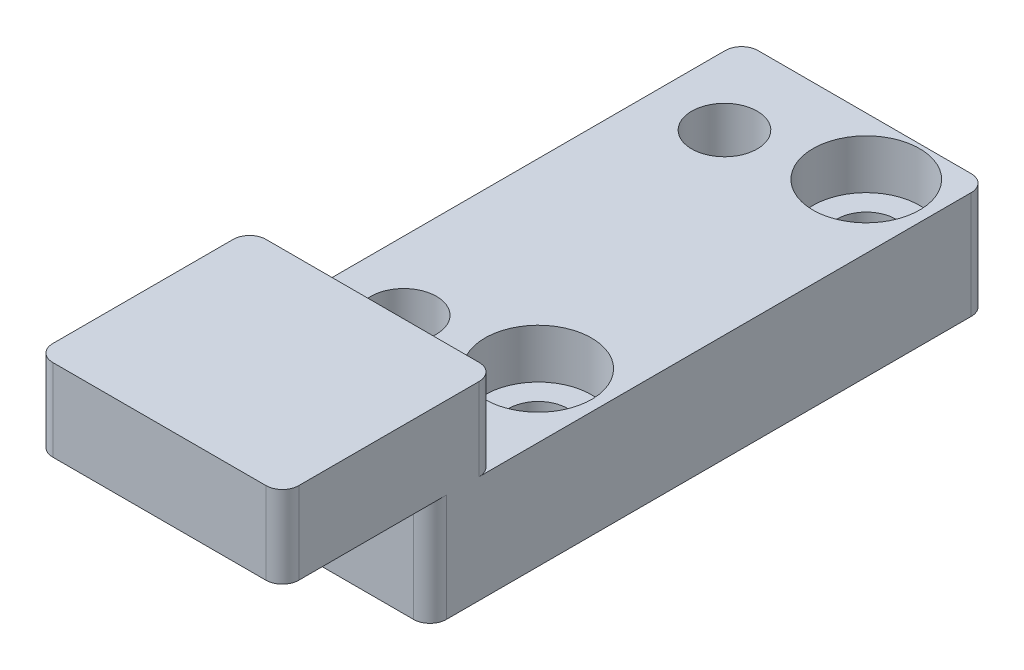
from build123d import *

# Parameters (mm, degrees)
SKETCH1_W                                      = 15
SKETCH1_H                                      = 6.539
BOSS_EXTRUDE1_DEPTH                            = 30
CBORE_FOR_M3_SHCS1_D                           = 3.6
CBORE_FOR_M3_SHCS1_CBORE_D                     = 6.5
CBORE_FOR_M3_SHCS1_CBORE_DEPTH                 = 3
CBORE_FOR_6_SOCKET_HEAD_CAP_SCREW1_D           = 3.997300108
CBORE_FOR_6_SOCKET_HEAD_CAP_SCREW1_CBORE_D     = 7.14502
CBORE_FOR_6_SOCKET_HEAD_CAP_SCREW1_CBORE_DEPTH = 3.5052
BOSS_EXTRUDE2_DEPTH                            = 15
FILLET1_R                                      = 1


with BuildPart() as part:
    # Sketch1 → Boss-Extrude1 (new body)
    with BuildSketch(Plane.XY):
        with Locations((7.5, 3.2695)):
            Rectangle(SKETCH1_W, SKETCH1_H)
    extrude(amount=BOSS_EXTRUDE1_DEPTH)

    # CBORE for M3 SHCS1 (through all)
    with Locations(Plane(origin=(0, 6.539, 0), x_dir=(1, 0, 0), z_dir=(0, 1, 0))):
        with Locations((11.1, -3.5), (11.1, -23.5)):
            CounterBoreHole(CBORE_FOR_M3_SHCS1_D / 2, CBORE_FOR_M3_SHCS1_CBORE_D / 2, CBORE_FOR_M3_SHCS1_CBORE_DEPTH)

    # CBORE for #6 Socket Head Cap Screw1 (through all)
    with Locations(Plane(origin=(0, 0, 0), x_dir=(-1, 0, 0), z_dir=(0, -1, 0))):
        with Locations((-4.175, -24.779), (-4.175, -5.221)):
            CounterBoreHole(CBORE_FOR_6_SOCKET_HEAD_CAP_SCREW1_D / 2, CBORE_FOR_6_SOCKET_HEAD_CAP_SCREW1_CBORE_D / 2, CBORE_FOR_6_SOCKET_HEAD_CAP_SCREW1_CBORE_DEPTH)

    # Sketch6 → Boss-Extrude2 (add)
    with BuildSketch(Plane.ZY):
        Polygon((30, 0), (34, 0), (34, 6.569), (43, 6.569), (43, 11.569), (30, 11.569), align=None)
    extrude(amount=-BOSS_EXTRUDE2_DEPTH)

    # Fillet1
    fillet1_edges = [part.edges().sort_by_distance(p)[0] for p in [
        (0, 9.054, 30),
        (0, 3.2845, 34),
        (0, 9.069, 43),
        (15, 9.054, 30),
        (15, 9.069, 43),
        (15, 3.2845, 34),
        (15, 3.2695, 0),
        (0, 3.2695, 0),
    ]]
    fillet(fillet1_edges, radius=FILLET1_R)


solid = part.part
